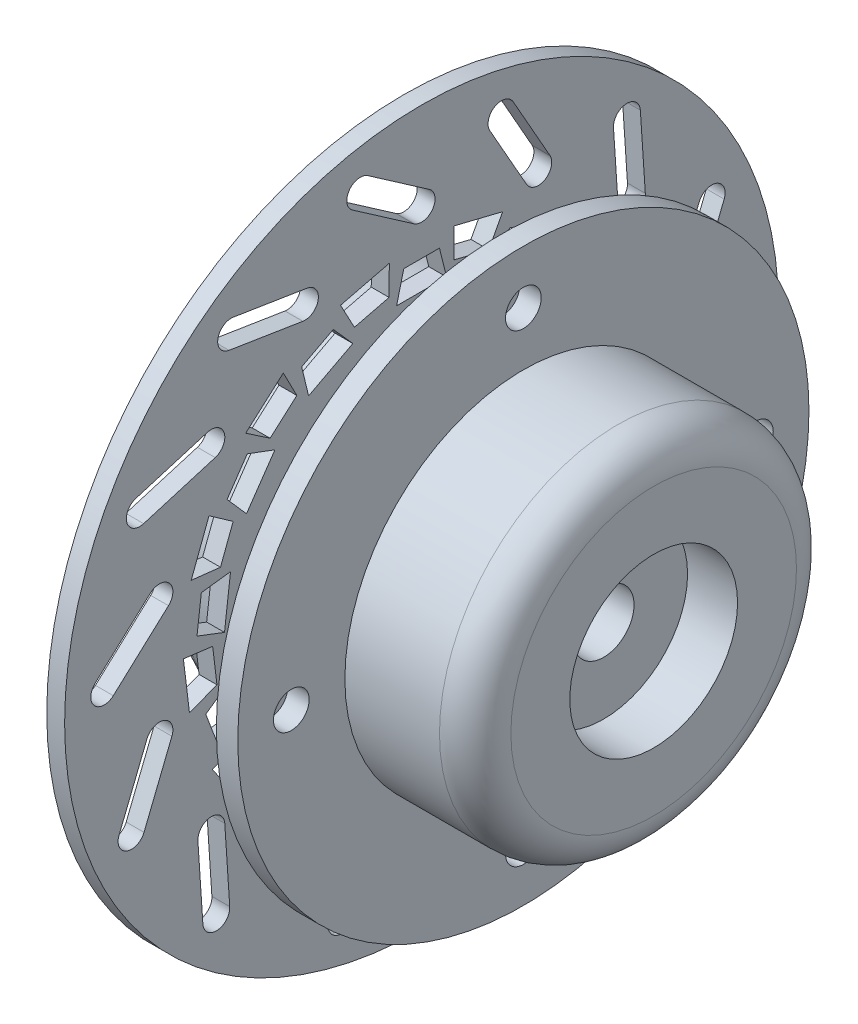
from build123d import *

# Parameters (mm, degrees)
SKETCH2_R          = 8.5
CUT_EXTRUDE1_DEPTH = 75
SKETCH3_R          = 23.5
CUT_EXTRUDE2_DEPTH = 14
CUT_EXTRUDE3_START = -14
SKETCH4_R          = 23.5
CUT_EXTRUDE3_DEPTH = 14
CUT_EXTRUDE4_DEPTH = 15
CUT_EXTRUDE5_DEPTH = 15
SKETCH7_R          = 5
CUT_EXTRUDE6_DEPTH = 15


with BuildPart() as part:
    # Sketch1 → Revolve1 (revolve)
    with BuildSketch(Plane(origin=(0, 0, 0), x_dir=(1, 0, 0), z_dir=(0, 1, 0)), mode=Mode.PRIVATE) as revolve1_sk:
        with BuildLine():
            Line((-42.5, 0), (-42.5, 47.663908119))
            ThreePointArc((-42.5, 47.663908119), (-41.621320344, 49.785228463), (-39.5, 50.663908119))
            Line((-39.5, 50.663908119), (-27.5, 50.663908119))
            Line((-27.5, 50.663908119), (-27.5, 100))
            Line((-27.5, 100), (-22.5, 100))
            Line((-22.5, 100), (-22.5, 40))
            Line((-22.5, 40), (0, 40))
            Line((0, 40), (0, 80))
            Line((0, 80), (6, 80))
            Line((6, 80), (6, 50))
            Line((6, 50), (32.5, 50))
            ThreePointArc((32.5, 50), (39.571067812, 47.071067812), (42.5, 40))
            Line((42.5, 40), (42.5, 0))
            Line((42.5, 0), (-42.5, 0))
        make_face()
    revolve(revolve1_sk.sketch.rotate(Axis((-42.5, 0, 0), (1, 0, 0)), 180), axis=Axis((-42.5, 0, 0), (1, 0, 0)))

    # Sketch2 → Cut-Extrude1 (cut)
    with BuildSketch(Plane(origin=(42.5, 0, 0), x_dir=(0, 0, -1), z_dir=(1, 0, 0))):
        Circle(SKETCH2_R)
    extrude(amount=-CUT_EXTRUDE1_DEPTH, mode=Mode.SUBTRACT)

    # Sketch3 → Cut-Extrude2 (cut)
    with BuildSketch(Plane.ZY.offset(42.5)):
        Circle(SKETCH3_R)
    extrude(amount=-CUT_EXTRUDE2_DEPTH, mode=Mode.SUBTRACT)

    # Sketch4 → Cut-Extrude3 (cut)
    with BuildSketch(Plane(origin=(42.5, 0, 0), x_dir=(0, 0, -1), z_dir=(1, 0, 0)).offset(CUT_EXTRUDE3_START)):
        with Locations(Location((0, 0, 0), (0, 0, 180))):
            Circle(SKETCH4_R)
    extrude(amount=CUT_EXTRUDE3_DEPTH, mode=Mode.SUBTRACT)

    # Sketch5 → Cut-Extrude4 (cut)
    with BuildSketch(Plane.ZY.offset(27.5)):
        Polygon((-7, 54.769866561), (7, 54.769866561), (5, 62.769866561), (-5, 62.769866561), align=None)
        Polygon((-5, -58.356306791), (5, -58.356306791), (7.031676201, -66.356306791), (-7.031676201, -66.356306791), align=None)
        Polygon((-31.546808129, -49.348327623), (-37.06355344, -55.48780882), (-24.611073315, -62.023374557), (-22.692247873, -53.995559344), align=None)
        Polygon((33.597891625, 53.256340715), (31.6510183, 45.243246166), (19.254633941, 51.749370575), (24.743331369, 57.903572436), align=None)
        Polygon((-50.866622696, -29.035241308), (-58.60461725, -31.907722548), (-50.615722529, -43.481634675), (-45.185975229, -37.265079967), align=None)
        Polygon((54.498911177, 31.542429021), (49.051169744, 25.351943315), (41.098263289, 36.873717438), (48.81826371, 39.77226768), align=None)
        Polygon((-58.533507013, -2.070531122), (-66.72006951, -1.01796157), (-65.024919698, -14.978776299), (-57.32814021, -11.997619863), align=None)
        Polygon((62.914886962, 2.602526965), (55.21428933, -0.347184225), (53.526775806, 13.550740012), (61.709520159, 12.529615706), align=None)
        Polygon((-52.791070278, 25.368512791), (-59.55075791, 30.105002136), (-64.5376914, 16.955539213), (-56.337119148, 16.018350365), align=None)
        Polygon((56.91782035, -26.933582655), (48.728480635, -25.966776044), (53.692949053, -12.876548646), (60.463869221, -17.583420228), align=None)
        Polygon((-34.954835544, 46.995936148), (-38.739085337, 54.331272657), (-49.265655765, 45.005545028), (-42.439943025, 40.364709566), align=None)
        Polygon((37.88156703, -50.299533073), (31.079564268, -45.637692404), (41.558714742, -36.353975189), (45.366674512, -43.668306491), align=None)
        Polygon((-9.110869238, 57.857156896), (-9.052755169, 66.110903375), (-22.70745211, 62.745322853), (-18.820287412, 55.464000253), align=None)
        Polygon((10.167103226, -62.142466639), (6.310694277, -54.853563429), (19.903879721, -51.503144129), (19.8765214, -59.749309996), align=None)
        Polygon((18.820287412, 55.464000253), (22.70745211, 62.745322853), (9.052755169, 66.110903375), (9.110869238, 57.857156896), align=None)
        Polygon((-19.8765214, -59.749309997), (-19.903879721, -51.503144129), (-6.310694277, -54.853563429), (-10.167103226, -62.142466639), align=None)
        Polygon((42.439943026, 40.364709566), (49.265655765, 45.005545028), (38.739085337, 54.331272657), (34.954835544, 46.995936148), align=None)
        Polygon((-45.366674512, -43.668306491), (-41.558714742, -36.353975189), (-31.079564268, -45.637692404), (-37.88156703, -50.299533073), align=None)
        Polygon((56.337119148, 16.018350365), (64.5376914, 16.955539213), (59.55075791, 30.105002135), (52.791070278, 25.368512791), align=None)
        Polygon((-60.463869221, -17.583420228), (-53.692949053, -12.876548646), (-48.728480635, -25.966776044), (-56.91782035, -26.933582655), align=None)
        Polygon((57.32814021, -11.997619863), (65.024919698, -14.978776299), (66.72006951, -1.01796157), (58.533507013, -2.070531122), align=None)
        Polygon((-61.709520159, 12.529615706), (-53.526775806, 13.550740012), (-55.21428933, -0.347184225), (-62.914886962, 2.602526965), align=None)
        Polygon((45.185975229, -37.265079967), (50.615722529, -43.481634675), (58.60461725, -31.907722548), (50.866622696, -29.035241308), align=None)
        Polygon((-48.81826371, 39.77226768), (-41.098263289, 36.873717437), (-49.051169744, 25.351943315), (-54.498911177, 31.542429021), align=None)
        Polygon((22.692247873, -53.995559344), (24.611073315, -62.023374557), (37.06355344, -55.48780882), (31.546808129, -49.348327623), align=None)
        Polygon((-24.743331369, 57.903572436), (-19.254633941, 51.749370575), (-31.6510183, 45.243246166), (-33.597891625, 53.256340715), align=None)
    extrude(amount=-CUT_EXTRUDE4_DEPTH, mode=Mode.SUBTRACT)

    # Sketch6 → Cut-Extrude5 (cut)
    with BuildSketch(Plane.ZY.offset(27.5)):
        with BuildLine():
            Line((-2.14845977, 78.42733855), (15.040985782, 90.358273899))
            ThreePointArc((15.040985782, 90.358273899), (20.284830042, 89.411349179), (19.337905321, 84.167504919))
            Line((19.337905321, 84.167504919), (2.14845977, 72.236569569))
            ThreePointArc((2.14845977, 72.236569569), (-3.09538449, 73.18349429), (-2.14845977, 78.42733855))
        make_face()
        with BuildLine():
            Line((32.092651532, 71.592772184), (52.756445671, 74.88395259))
            ThreePointArc((52.756445671, 74.88395259), (57.07013086, 71.755584142), (53.941762412, 67.441898954))
            Line((53.941762412, 67.441898954), (33.277968272, 64.150718548))
            ThreePointArc((33.277968272, 64.150718548), (28.964283084, 67.279086996), (32.092651532, 71.592772184))
        make_face()
        with BuildLine():
            Line((59.977419608, 50.57837926), (80.022844481, 44.577946078))
            ThreePointArc((80.022844481, 44.577946078), (82.551992342, 39.887745641), (77.861791904, 37.35859778))
            Line((77.861791904, 37.35859778), (57.816367031, 43.359030961))
            ThreePointArc((57.816367031, 43.359030961), (55.28721917, 48.049231399), (59.977419608, 50.57837926))
        make_face()
        with BuildLine():
            Line((75.982924156, 19.54631802), (91.439737525, 5.442730634))
            ThreePointArc((91.439737525, 5.442730634), (91.683419307, 0.119649924), (86.360338597, -0.124031858))
            Line((86.360338597, -0.124031858), (70.903525228, 13.979555529))
            ThreePointArc((70.903525228, 13.979555529), (70.659843446, 19.302636238), (75.982924156, 19.54631802))
        make_face()
        with BuildLine():
            Line((76.939078705, -15.357131224), (84.745869117, -34.770484364))
            ThreePointArc((84.745869117, -34.770484364), (82.655820655, -39.672143927), (77.754161091, -37.582095464))
            Line((77.754161091, -37.582095464), (69.947370679, -18.168742324))
            ThreePointArc((69.947370679, -18.168742324), (72.037419142, -13.267082761), (76.939078705, -15.357131224))
        make_face()
        with BuildLine():
            Line((62.656505121, -47.218912286), (61.267041991, -68.096978501))
            ThreePointArc((61.267041991, -68.096978501), (57.257223015, -71.606383127), (53.747818389, -67.59656415))
            Line((53.747818389, -67.59656415), (55.137281519, -46.718497935))
            ThreePointArc((55.137281519, -46.718497935), (59.147100495, -43.209093309), (62.656505121, -47.218912286))
        make_face()
        with BuildLine():
            Line((35.964042266, -69.728408667), (25.653525808, -87.936030892))
            ThreePointArc((25.653525808, -87.936030892), (20.518130143, -89.358099953), (19.096061081, -84.222704289))
            Line((19.096061081, -84.222704289), (29.406577539, -66.015082064))
            ThreePointArc((29.406577539, -66.015082064), (34.541973204, -64.593013003), (35.964042266, -69.728408667))
        make_face()
        with BuildLine():
            Line((2.14845977, -78.42733855), (-15.040985782, -90.358273899))
            ThreePointArc((-15.040985782, -90.358273899), (-20.284830042, -89.411349179), (-19.337905321, -84.167504919))
            Line((-19.337905321, -84.167504919), (-2.14845977, -72.236569569))
            ThreePointArc((-2.14845977, -72.236569569), (3.09538449, -73.18349429), (2.14845977, -78.42733855))
        make_face()
        with BuildLine():
            Line((-32.092651532, -71.592772184), (-52.756445671, -74.88395259))
            ThreePointArc((-52.756445671, -74.88395259), (-57.07013086, -71.755584142), (-53.941762412, -67.441898954))
            Line((-53.941762412, -67.441898954), (-33.277968272, -64.150718548))
            ThreePointArc((-33.277968272, -64.150718548), (-28.964283084, -67.279086996), (-32.092651532, -71.592772184))
        make_face()
        with BuildLine():
            Line((-59.977419608, -50.57837926), (-80.022844481, -44.577946078))
            ThreePointArc((-80.022844481, -44.577946078), (-82.551992342, -39.887745641), (-77.861791904, -37.35859778))
            Line((-77.861791904, -37.35859778), (-57.816367031, -43.359030961))
            ThreePointArc((-57.816367031, -43.359030961), (-55.28721917, -48.049231399), (-59.977419608, -50.57837926))
        make_face()
        with BuildLine():
            Line((-75.982924156, -19.54631802), (-91.439737525, -5.442730634))
            ThreePointArc((-91.439737525, -5.442730634), (-91.683419307, -0.119649924), (-86.360338597, 0.124031858))
            Line((-86.360338597, 0.124031858), (-70.903525228, -13.979555529))
            ThreePointArc((-70.903525228, -13.979555529), (-70.659843446, -19.302636238), (-75.982924156, -19.54631802))
        make_face()
        with BuildLine():
            Line((-76.939078705, 15.357131224), (-84.745869117, 34.770484364))
            ThreePointArc((-84.745869117, 34.770484364), (-82.655820655, 39.672143927), (-77.754161091, 37.582095464))
            Line((-77.754161091, 37.582095464), (-69.947370679, 18.168742324))
            ThreePointArc((-69.947370679, 18.168742324), (-72.037419142, 13.267082761), (-76.939078705, 15.357131224))
        make_face()
        with BuildLine():
            Line((-62.656505121, 47.218912286), (-61.267041991, 68.096978501))
            ThreePointArc((-61.267041991, 68.096978501), (-57.257223015, 71.606383127), (-53.747818389, 67.59656415))
            Line((-53.747818389, 67.59656415), (-55.137281519, 46.718497935))
            ThreePointArc((-55.137281519, 46.718497935), (-59.147100495, 43.209093309), (-62.656505121, 47.218912286))
        make_face()
        with BuildLine():
            Line((-35.964042266, 69.728408667), (-25.653525808, 87.936030892))
            ThreePointArc((-25.653525808, 87.936030892), (-20.518130143, 89.358099953), (-19.096061081, 84.222704289))
            Line((-19.096061081, 84.222704289), (-29.406577539, 66.015082064))
            ThreePointArc((-29.406577539, 66.015082064), (-34.541973204, 64.593013003), (-35.964042266, 69.728408667))
        make_face()
    extrude(amount=-CUT_EXTRUDE5_DEPTH, mode=Mode.SUBTRACT)

    # Sketch7 → Cut-Extrude6 (cut)
    with BuildSketch(Plane(origin=(6, 0, 0), x_dir=(0, 0, -1), z_dir=(1, 0, 0))):
        with Locations((65, 0)):
            Circle(SKETCH7_R)
        with Locations((0, -65)):
            Circle(SKETCH7_R)
        with Locations((-65, 0)):
            Circle(SKETCH7_R)
        with Locations((0, 65)):
            Circle(SKETCH7_R)
    extrude(amount=-CUT_EXTRUDE6_DEPTH, mode=Mode.SUBTRACT)


solid = part.part
